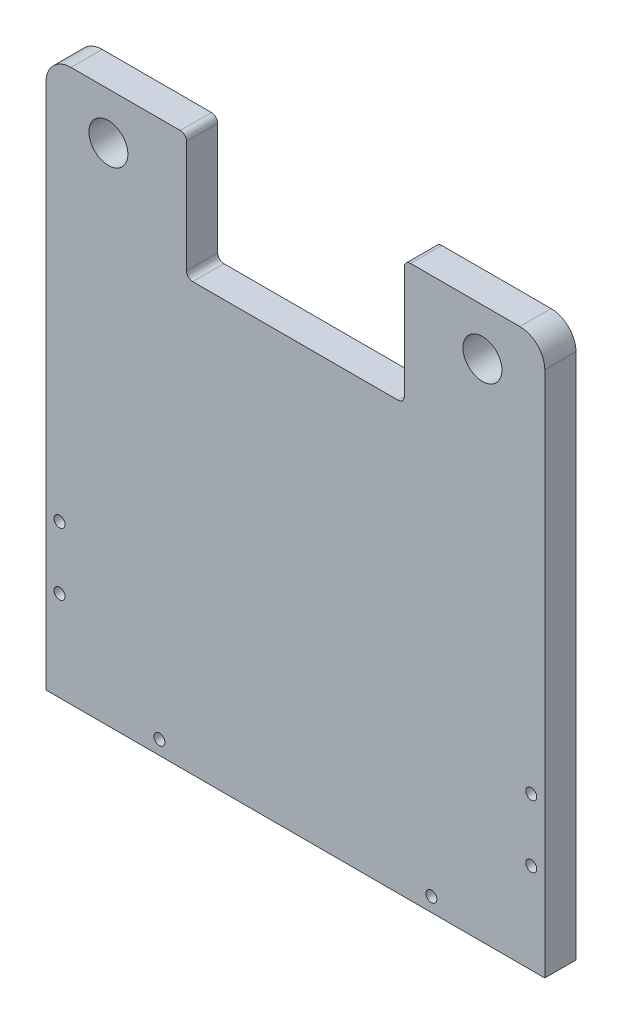
from build123d import *

# Parameters (mm, degrees)
SKETCH1_R           = 6.25
SKETCH1_R_2         = 1.75
BOSS_EXTRUDE1_DEPTH = 10


with BuildPart() as part:
    # Sketch1 → Boss-Extrude1 (new body)
    with BuildSketch(Plane.XY):
        with BuildLine():
            Line((40.062548905, 177), (43.062548905, 177))
            ThreePointArc((43.062548905, 177), (44.476762467, 176.414213562), (45.062548905, 175))
            Line((45.062548905, 175), (45.062548905, 139))
            ThreePointArc((45.062548905, 139), (45.648335342, 137.585786438), (47.062548905, 137))
            Line((47.062548905, 137), (112.937451095, 137))
            ThreePointArc((112.937451095, 137), (114.351664658, 137.585786438), (114.937451095, 139))
            Line((114.937451095, 139), (114.937451095, 175))
            ThreePointArc((114.937451095, 175), (115.523237533, 176.414213562), (116.937451095, 177))
            Line((116.937451095, 177), (120, 177))
            Line((120, 177), (152, 177))
            ThreePointArc((152, 177), (157.656854249, 174.656854249), (160, 169))
            Line((160, 169), (160, 0))
            Line((160, 0), (120, 0))
            Line((120, 0), (40, 0))
            Line((40, 0), (0, 0))
            Line((0, 0), (0, 169))
            ThreePointArc((0, 169), (2.343145751, 174.656854249), (8, 177))
            Line((8, 177), (40, 177))
            Line((40, 177), (40.062548905, 177))
        make_face()
        with Locations((20, 162)):
            Circle(SKETCH1_R, mode=Mode.SUBTRACT)
        with Locations((140, 162)):
            Circle(SKETCH1_R, mode=Mode.SUBTRACT)
        with Locations((4.328403696, 49)):
            Circle(SKETCH1_R_2, mode=Mode.SUBTRACT)
        with Locations((4.328403696, 29)):
            Circle(SKETCH1_R_2, mode=Mode.SUBTRACT)
        with Locations((36.371302772, 4.5)):
            Circle(SKETCH1_R_2, mode=Mode.SUBTRACT)
        with Locations((123.628697228, 4.5)):
            Circle(SKETCH1_R_2, mode=Mode.SUBTRACT)
        with Locations((155.671596304, 29)):
            Circle(SKETCH1_R_2, mode=Mode.SUBTRACT)
        with Locations((155.671596304, 49)):
            Circle(SKETCH1_R_2, mode=Mode.SUBTRACT)
    extrude(amount=BOSS_EXTRUDE1_DEPTH)


solid = part.part
